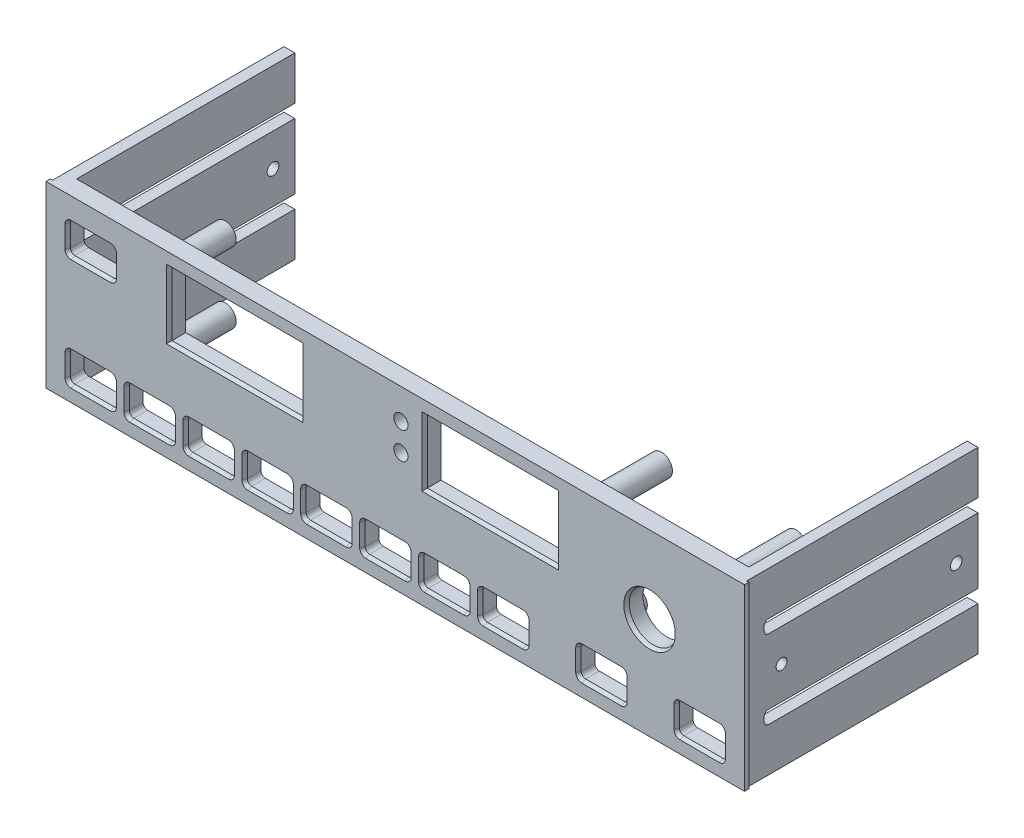
from build123d import *

# Parameters (mm, degrees)
ESQUISSE1_W             = 160
ESQUISSE1_H             = 41
BOSS_EXTRU_1_DEPTH      = 4
ESQUISSE2_R             = 5.5
ESQUISSE2_R_2           = 1.625
ESQUISSE2_W             = 30.5
ESQUISSE2_H             = 15
ENL_V_MAT_EXTRU_1_DEPTH = 4
ESQUISSE4_W             = 3
ESQUISSE4_H             = 41
BOSS_EXTRU_2_DEPTH      = 50
ENL_V_MAT_EXTRU_2_DEPTH = 173.571724219
ESQUISSE7_R             = 2.5
ESQUISSE7_R_2           = 1.25
BOSS_EXTRU_3_DEPTH      = 15
CHANFREIN1_SIZE         = 0.4
CHANFREIN1_SIZE2        = 0.857802768
ESQUISSE9_R             = 1.25
ESQUISSE9_R_2           = 1.35
ENL_V_MAT_EXTRU_3_DEPTH = 900
ENL_V_START             = -1
ESQUISSE10_W            = 12.385186808
ESQUISSE10_H            = 54.185192286
ESQUISSE10_W_2          = 10.977779216
ESQUISSE10_H_2          = 57.844452025
ENL_V_MAT_EXTRU_5_DEPTH = 173.772840225


with BuildPart() as part:
    # Esquisse1 → Boss.-Extru.1 (new body)
    with BuildSketch(Plane.XY):
        with Locations((80, 20.5)):
            Rectangle(ESQUISSE1_W, ESQUISSE1_H)
    extrude(amount=BOSS_EXTRU_1_DEPTH)

    # Esquisse2 → Enlèv. mat.-Extru.1 (cut)
    with BuildSketch(Plane.XY.offset(4)):
        with Locations((138.25, 23.25)):
            Circle(ESQUISSE2_R)
        with Locations((81.3, 34.05)):
            Circle(ESQUISSE2_R_2)
        with Locations((81.3, 27.83)):
            Circle(ESQUISSE2_R_2)
        with BuildLine():
            Line((19.25, 10.25), (28.25, 10.25))
            ThreePointArc((28.25, 10.25), (28.957106781, 9.957106781), (29.25, 9.25))
            Line((29.25, 9.25), (29.25, 4.25))
            ThreePointArc((29.25, 4.25), (28.957106781, 3.542893219), (28.25, 3.25))
            Line((28.25, 3.25), (19.25, 3.25))
            ThreePointArc((19.25, 3.25), (18.542893219, 3.542893219), (18.25, 4.25))
            Line((18.25, 4.25), (18.25, 9.25))
            ThreePointArc((18.25, 9.25), (18.542893219, 9.957106781), (19.25, 10.25))
        make_face()
        with BuildLine():
            Line((5.75, 3.25), (14.75, 3.25))
            ThreePointArc((14.75, 3.25), (15.457106781, 3.542893219), (15.75, 4.25))
            Line((15.75, 4.25), (15.75, 9.25))
            ThreePointArc((15.75, 9.25), (15.457106781, 9.957106781), (14.75, 10.25))
            Line((14.75, 10.25), (5.75, 10.25))
            ThreePointArc((5.75, 10.25), (5.042893219, 9.957106781), (4.75, 9.25))
            Line((4.75, 9.25), (4.75, 4.25))
            ThreePointArc((4.75, 4.25), (5.042893219, 3.542893219), (5.75, 3.25))
        make_face()
        with BuildLine():
            Line((32.75, 10.25), (41.75, 10.25))
            ThreePointArc((41.75, 10.25), (42.457106781, 9.957106781), (42.75, 9.25))
            Line((42.75, 9.25), (42.75, 4.25))
            ThreePointArc((42.75, 4.25), (42.457106781, 3.542893219), (41.75, 3.25))
            Line((41.75, 3.25), (32.75, 3.25))
            ThreePointArc((32.75, 3.25), (32.042893219, 3.542893219), (31.75, 4.25))
            Line((31.75, 4.25), (31.75, 9.25))
            ThreePointArc((31.75, 9.25), (32.042893219, 9.957106781), (32.75, 10.25))
        make_face()
        with BuildLine():
            Line((46.25, 10.25), (55.25, 10.25))
            ThreePointArc((55.25, 10.25), (55.957106781, 9.957106781), (56.25, 9.25))
            Line((56.25, 9.25), (56.25, 4.25))
            ThreePointArc((56.25, 4.25), (55.957106781, 3.542893219), (55.25, 3.25))
            Line((55.25, 3.25), (46.25, 3.25))
            ThreePointArc((46.25, 3.25), (45.542893219, 3.542893219), (45.25, 4.25))
            Line((45.25, 4.25), (45.25, 9.25))
            ThreePointArc((45.25, 9.25), (45.542893219, 9.957106781), (46.25, 10.25))
        make_face()
        with BuildLine():
            Line((59.75, 10.25), (68.75, 10.25))
            ThreePointArc((68.75, 10.25), (69.457106781, 9.957106781), (69.75, 9.25))
            Line((69.75, 9.25), (69.75, 4.25))
            ThreePointArc((69.75, 4.25), (69.457106781, 3.542893219), (68.75, 3.25))
            Line((68.75, 3.25), (59.75, 3.25))
            ThreePointArc((59.75, 3.25), (59.042893219, 3.542893219), (58.75, 4.25))
            Line((58.75, 4.25), (58.75, 9.25))
            ThreePointArc((58.75, 9.25), (59.042893219, 9.957106781), (59.75, 10.25))
        make_face()
        with BuildLine():
            Line((73.25, 10.25), (82.25, 10.25))
            ThreePointArc((82.25, 10.25), (82.957106781, 9.957106781), (83.25, 9.25))
            Line((83.25, 9.25), (83.25, 4.25))
            ThreePointArc((83.25, 4.25), (82.957106781, 3.542893219), (82.25, 3.25))
            Line((82.25, 3.25), (73.25, 3.25))
            ThreePointArc((73.25, 3.25), (72.542893219, 3.542893219), (72.25, 4.25))
            Line((72.25, 4.25), (72.25, 9.25))
            ThreePointArc((72.25, 9.25), (72.542893219, 9.957106781), (73.25, 10.25))
        make_face()
        with BuildLine():
            Line((86.75, 10.25), (95.75, 10.25))
            ThreePointArc((95.75, 10.25), (96.457106781, 9.957106781), (96.75, 9.25))
            Line((96.75, 9.25), (96.75, 4.25))
            ThreePointArc((96.75, 4.25), (96.457106781, 3.542893219), (95.75, 3.25))
            Line((95.75, 3.25), (86.75, 3.25))
            ThreePointArc((86.75, 3.25), (86.042893219, 3.542893219), (85.75, 4.25))
            Line((85.75, 4.25), (85.75, 9.25))
            ThreePointArc((85.75, 9.25), (86.042893219, 9.957106781), (86.75, 10.25))
        make_face()
        with BuildLine():
            Line((100.25, 10.25), (109.25, 10.25))
            ThreePointArc((109.25, 10.25), (109.957106781, 9.957106781), (110.25, 9.25))
            Line((110.25, 9.25), (110.25, 4.25))
            ThreePointArc((110.25, 4.25), (109.957106781, 3.542893219), (109.25, 3.25))
            Line((109.25, 3.25), (100.25, 3.25))
            ThreePointArc((100.25, 3.25), (99.542893219, 3.542893219), (99.25, 4.25))
            Line((99.25, 4.25), (99.25, 9.25))
            ThreePointArc((99.25, 9.25), (99.542893219, 9.957106781), (100.25, 10.25))
        make_face()
        with BuildLine():
            Line((122.75, 3.25), (131.75, 3.25))
            ThreePointArc((131.75, 3.25), (132.457106781, 3.542893219), (132.75, 4.25))
            Line((132.75, 4.25), (132.75, 9.25))
            ThreePointArc((132.75, 9.25), (132.457106781, 9.957106781), (131.75, 10.25))
            Line((131.75, 10.25), (122.75, 10.25))
            ThreePointArc((122.75, 10.25), (122.042893219, 9.957106781), (121.75, 9.25))
            Line((121.75, 9.25), (121.75, 4.25))
            ThreePointArc((121.75, 4.25), (122.042893219, 3.542893219), (122.75, 3.25))
        make_face()
        with BuildLine():
            Line((145.25, 3.25), (154.25, 3.25))
            ThreePointArc((154.25, 3.25), (154.957106781, 3.542893219), (155.25, 4.25))
            Line((155.25, 4.25), (155.25, 9.25))
            ThreePointArc((155.25, 9.25), (154.957106781, 9.957106781), (154.25, 10.25))
            Line((154.25, 10.25), (145.25, 10.25))
            ThreePointArc((145.25, 10.25), (144.542893219, 9.957106781), (144.25, 9.25))
            Line((144.25, 9.25), (144.25, 4.25))
            ThreePointArc((144.25, 4.25), (144.542893219, 3.542893219), (145.25, 3.25))
        make_face()
        with BuildLine():
            Line((5.75, 35.75), (14.75, 35.75))
            ThreePointArc((14.75, 35.75), (15.457106781, 35.457106781), (15.75, 34.75))
            Line((15.75, 34.75), (15.75, 29.75))
            ThreePointArc((15.75, 29.75), (15.457106781, 29.042893219), (14.75, 28.75))
            Line((14.75, 28.75), (5.75, 28.75))
            ThreePointArc((5.75, 28.75), (5.042893219, 29.042893219), (4.75, 29.75))
            Line((4.75, 29.75), (4.75, 34.75))
            ThreePointArc((4.75, 34.75), (5.042893219, 35.457106781), (5.75, 35.75))
        make_face()
        with Locations((43.25, 30.5)):
            Rectangle(ESQUISSE2_W, ESQUISSE2_H)
        with Locations((101.75, 30.5)):
            Rectangle(ESQUISSE2_W, ESQUISSE2_H)
    extrude(amount=-ENL_V_MAT_EXTRU_1_DEPTH, mode=Mode.SUBTRACT)

    # Esquisse4 → Boss.-Extru.2 (add)
    with BuildSketch(Plane(origin=(0, 0, 0), x_dir=(-1, 0, 0), z_dir=(0, 0, -1))):
        with Locations((-158.5, 20.5)):
            Rectangle(ESQUISSE4_W, ESQUISSE4_H)
        with Locations((-1.5, 20.5)):
            Rectangle(ESQUISSE4_W, ESQUISSE4_H)
    extrude(amount=BOSS_EXTRU_2_DEPTH)

    # Esquisse5 → Enlèv. mat.-Extru.2 (cut, through all)
    with BuildSketch(Plane(origin=(160, 0, 0), x_dir=(0, 0, -1), z_dir=(1, 0, 0))):
        with BuildLine():
            Line((50, 13), (2, 13))
            ThreePointArc((2, 13), (1.292893219, 12.707106781), (1, 12))
            Line((1, 12), (1, 11))
            ThreePointArc((1, 11), (1.292893219, 10.292893219), (2, 10))
            Line((2, 10), (50, 10))
            Line((50, 10), (50, 13))
        make_face()
        with BuildLine():
            Line((50, 31), (2, 31))
            ThreePointArc((2, 31), (1.292893219, 30.707106781), (1, 30))
            Line((1, 30), (1, 29))
            ThreePointArc((1, 29), (1.292893219, 28.292893219), (2, 28))
            Line((2, 28), (50, 28))
            Line((50, 28), (50, 31))
        make_face()
    extrude(amount=-ENL_V_MAT_EXTRU_2_DEPTH, mode=Mode.SUBTRACT)

    # Esquisse7 → Boss.-Extru.3 (add)
    # profile 1 of 7: a face of its own
    with BuildSketch(Plane(origin=(0, 0, 0), x_dir=(-1, 0, 0), z_dir=(0, 0, -1))):
        with Locations((-22.066417501, 32.220467417)):
            Circle(ESQUISSE7_R)
        with Locations((-22.066417501, 32.220467417)):
            Circle(ESQUISSE7_R_2, mode=Mode.SUBTRACT)
    # profile 2 of 7: a face of its own
    with BuildSketch(Plane(origin=(0, 0, 0), x_dir=(-1, 0, 0), z_dir=(0, 0, -1))):
        with Locations((-22.066417501, 15.960655172)):
            Circle(ESQUISSE7_R)
        with Locations((-22.066417501, 15.960655172)):
            Circle(ESQUISSE7_R_2, mode=Mode.SUBTRACT)
    # profile 3 of 7: a face of its own
    with BuildSketch(Plane(origin=(0, 0, 0), x_dir=(-1, 0, 0), z_dir=(0, 0, -1))):
        with Locations((-152.81245368, 36.297265299)):
            Circle(ESQUISSE7_R)
        with Locations((-152.81245368, 36.297265299)):
            Circle(ESQUISSE7_R_2, mode=Mode.SUBTRACT)
    # profile 4 of 7: a face of its own
    with BuildSketch(Plane(origin=(0, 0, 0), x_dir=(-1, 0, 0), z_dir=(0, 0, -1))):
        with Locations((-152.81245368, 14.495559759)):
            Circle(ESQUISSE7_R)
        with Locations((-152.81245368, 14.495559759)):
            Circle(ESQUISSE7_R_2, mode=Mode.SUBTRACT)
    # profile 5 of 7: a face of its own
    with BuildSketch(Plane(origin=(0, 0, 0), x_dir=(-1, 0, 0), z_dir=(0, 0, -1))):
        with Locations((-122, 36.297265299)):
            Circle(ESQUISSE7_R)
        with Locations((-122, 36.297265299)):
            Circle(ESQUISSE7_R_2, mode=Mode.SUBTRACT)
    # profile 6 of 7: a face of its own
    with BuildSketch(Plane(origin=(0, 0, 0), x_dir=(-1, 0, 0), z_dir=(0, 0, -1))):
        with Locations((-116.25, 6.75)):
            Circle(ESQUISSE7_R)
        with Locations((-116.25, 6.75)):
            Circle(ESQUISSE7_R_2, mode=Mode.SUBTRACT)
    # profile 7 of 7: a face of its own
    with BuildSketch(Plane(origin=(0, 0, 0), x_dir=(-1, 0, 0), z_dir=(0, 0, -1))):
        with Locations((-63.5, 14.495559759)):
            Circle(ESQUISSE7_R)
        with Locations((-63.5, 14.495559759)):
            Circle(ESQUISSE7_R_2, mode=Mode.SUBTRACT)
    extrude(amount=BOSS_EXTRU_3_DEPTH)

    # Chanfrein1
    chanfrein1_edges = [part.edges().sort_by_distance(p)[0] for p in [
        (101.75, 38, 4),
        (117, 30.5, 4),
        (101.75, 23, 4),
        (86.5, 30.5, 4),
        (58.5, 30.5, 4),
        (43.25, 23, 4),
        (28, 30.5, 4),
        (43.25, 38, 4),
        (132.75, 23.25, 4),
        (149.75, 3.25, 4),
        (154.957106781, 3.542893219, 4),
        (144.542893219, 3.542893219, 4),
        (155.25, 6.75, 4),
        (144.25, 6.75, 4),
        (154.957106781, 9.957106781, 4),
        (144.542893219, 9.957106781, 4),
        (149.75, 10.25, 4),
        (127.25, 3.25, 4),
        (132.457106781, 3.542893219, 4),
        (122.042893219, 3.542893219, 4),
        (132.75, 6.75, 4),
        (121.75, 6.75, 4),
        (132.457106781, 9.957106781, 4),
        (122.042893219, 9.957106781, 4),
        (127.25, 10.25, 4),
        (104.75, 3.25, 4),
        (109.957106781, 3.542893219, 4),
        (99.542893219, 3.542893219, 4),
        (110.25, 6.75, 4),
        (99.25, 6.75, 4),
        (109.957106781, 9.957106781, 4),
        (99.542893219, 9.957106781, 4),
        (104.75, 10.25, 4),
        (91.25, 3.25, 4),
        (96.457106781, 3.542893219, 4),
        (86.042893219, 3.542893219, 4),
        (96.75, 6.75, 4),
        (85.75, 6.75, 4),
        (96.457106781, 9.957106781, 4),
        (86.042893219, 9.957106781, 4),
        (91.25, 10.25, 4),
        (77.75, 3.25, 4),
        (82.957106781, 3.542893219, 4),
        (72.542893219, 3.542893219, 4),
        (83.25, 6.75, 4),
        (72.25, 6.75, 4),
        (82.957106781, 9.957106781, 4),
        (72.542893219, 9.957106781, 4),
        (77.75, 10.25, 4),
        (64.25, 3.25, 4),
        (69.457106781, 3.542893219, 4),
        (59.042893219, 3.542893219, 4),
        (69.75, 6.75, 4),
        (58.75, 6.75, 4),
        (69.457106781, 9.957106781, 4),
        (59.042893219, 9.957106781, 4),
        (64.25, 10.25, 4),
        (50.75, 3.25, 4),
        (55.957106781, 3.542893219, 4),
        (45.542893219, 3.542893219, 4),
        (56.25, 6.75, 4),
        (45.25, 6.75, 4),
        (55.957106781, 9.957106781, 4),
        (45.542893219, 9.957106781, 4),
        (50.75, 10.25, 4),
        (37.25, 3.25, 4),
        (42.457106781, 3.542893219, 4),
        (32.042893219, 3.542893219, 4),
        (42.75, 6.75, 4),
        (31.75, 6.75, 4),
        (42.457106781, 9.957106781, 4),
        (32.042893219, 9.957106781, 4),
        (37.25, 10.25, 4),
        (23.75, 3.25, 4),
        (28.957106781, 3.542893219, 4),
        (18.542893219, 3.542893219, 4),
        (29.25, 6.75, 4),
        (18.25, 6.75, 4),
        (28.957106781, 9.957106781, 4),
        (18.542893219, 9.957106781, 4),
        (23.75, 10.25, 4),
        (10.25, 3.25, 4),
        (15.457106781, 3.542893219, 4),
        (5.042893219, 3.542893219, 4),
        (15.75, 6.75, 4),
        (4.75, 6.75, 4),
        (15.457106781, 9.957106781, 4),
        (5.042893219, 9.957106781, 4),
        (10.25, 10.25, 4),
        (10.25, 35.75, 4),
        (5.042893219, 35.457106781, 4),
        (15.457106781, 35.457106781, 4),
        (4.75, 32.25, 4),
        (15.75, 32.25, 4),
        (5.042893219, 29.042893219, 4),
        (15.457106781, 29.042893219, 4),
        (10.25, 28.75, 4),
    ]]
    chanfrein1_side = [part.faces().sort_by_distance(p)[0] for p in [
        (82.430470131, 20.497923343, 4),
    ]]
    chamfer(chanfrein1_edges, length=CHANFREIN1_SIZE, length2=CHANFREIN1_SIZE2, reference=chanfrein1_side[0])

    # Esquisse9 → Enlèv. mat.-Extru.3 (cut)
    with BuildSketch(Plane(origin=(160, 0, 0), x_dir=(0, 0, -1), z_dir=(1, 0, 0))):
        with Locations((5, 20.5)):
            Circle(ESQUISSE9_R)
        with Locations((45, 20.5)):
            Circle(ESQUISSE9_R_2)
    extrude(amount=-ENL_V_MAT_EXTRU_3_DEPTH, mode=Mode.SUBTRACT)

    # Esquisse10 → Enlèv. mat.-Extru.5 (cut, through all)
    with BuildSketch(Plane.XY.offset(4).offset(ENL_V_START)):
        with Locations((-5.692593404, 19.595563324)):
            Rectangle(ESQUISSE10_W, ESQUISSE10_H)
        with Locations((164.988889608, 19.032600287)):
            Rectangle(ESQUISSE10_W_2, ESQUISSE10_H_2)
    extrude(amount=-ENL_V_MAT_EXTRU_5_DEPTH, mode=Mode.SUBTRACT)


solid = part.part
